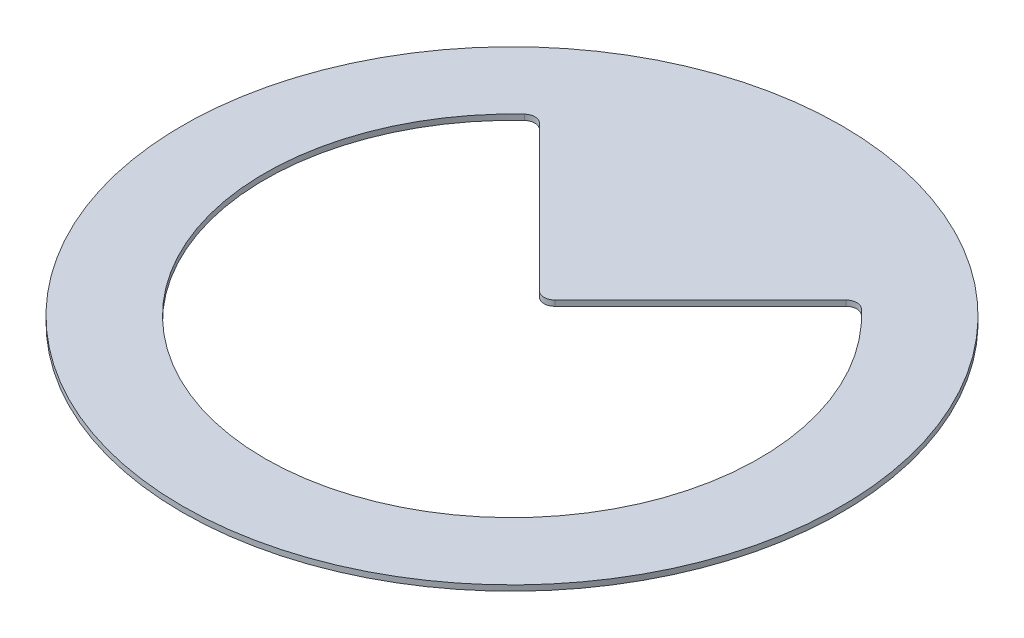
from build123d import *

# Parameters (mm, degrees)
SKETCH1_R           = 60
BOSS_EXTRUDE1_DEPTH = 1
FILLET1_R           = 2


with BuildPart() as part:
    # Sketch1 → Boss-Extrude1 (new body)
    with BuildSketch(Plane(origin=(0, 0, 0), x_dir=(1, 0, 0), z_dir=(0, 1, 0))):
        with Locations(Location((0, 0, 0), (0, 0, 270))):
            Circle(SKETCH1_R)
        with BuildLine():
            Line((-29.221443851, 34.221443851), (0, 5))
            Line((0, 5), (29.221443851, 34.221443851))
            ThreePointArc((29.221443851, 34.221443851), (0, -45), (-29.221443851, 34.221443851))
        make_face(mode=Mode.SUBTRACT)
    extrude(amount=BOSS_EXTRUDE1_DEPTH)

    # Fillet1
    fillet1_edges = [part.edges().sort_by_distance(p)[0] for p in [
        (-29.221443851, 0.5, -34.221443851),
        (29.221443851, 0.5, -34.221443851),
        (0, 0.5, -5),
    ]]
    fillet(fillet1_edges, radius=FILLET1_R)


solid = part.part
